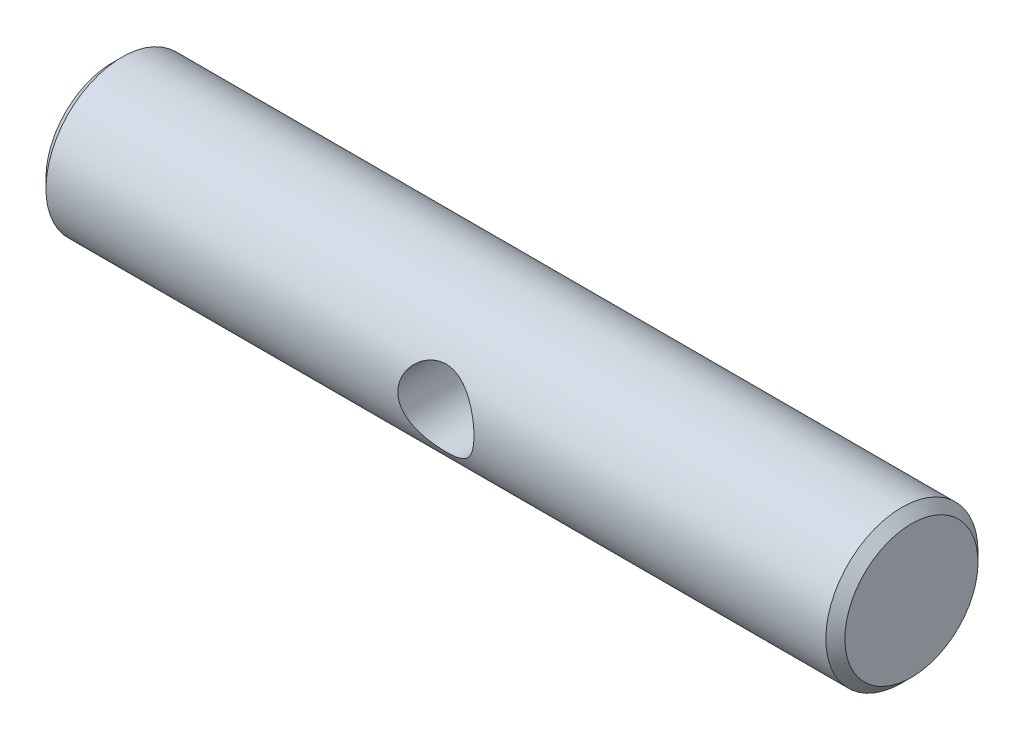
from build123d import *

# Parameters (mm, degrees)
CUT_EXTRUDE_START   = -3.5
CUT_EXTRUDE_1_DEPTH = 10
SKETCH_3_W          = 4
SKETCH_3_H          = 19.670556204
CUT_EXTRUDE_2_DEPTH = 10
CUT_EXTRUDE_START_2 = -29
SKETCH_4_R          = 4
SKETCH_4_R_2        = 2
CUT_EXTRUDE_3_DEPTH = 29
SKETCH_5_R          = 1
CUT_EXTRUDE_4_DEPTH = 5
CHAMFER_1_SIZE      = 0.25


with BuildPart() as part:
    # 草图1 → 旋转2 (revolve)
    with BuildSketch(Plane.XY, mode=Mode.PRIVATE) as revolve_2_sk:
        Polygon((0, 2), (0, 0), (17, 0), (21, 0), (21, 2), (17, 2), (17, 4), (4, 4), (4, 2), align=None)
    revolve(revolve_2_sk.sketch.rotate(Axis((-16.701754386, 0, 0), (1, 0, 0)), 180), axis=Axis((-16.701754386, 0, 0), (1, 0, 0)))

    # 草图2 → 切除-拉伸1 (cut)
    with BuildSketch(Plane.XY.offset(CUT_EXTRUDE_START)):
        Polygon((12.5, -5.827233832), (12.5, 4), (10.5, 4), (8.5, 4), (8.5, -5.827233832), align=None)
    extrude(amount=-CUT_EXTRUDE_1_DEPTH, mode=Mode.SUBTRACT)

    # 草图3 → 切除-拉伸2 (cut)
    with BuildSketch(Plane(origin=(0, 0, 0), x_dir=(1, 0, 0), z_dir=(0, 1, 0)).offset(CUT_EXTRUDE_START)):
        with Locations((10.5, 3.5)):
            Rectangle(SKETCH_3_W, SKETCH_3_H)
    extrude(amount=-CUT_EXTRUDE_2_DEPTH, mode=Mode.SUBTRACT)

    # 草图4 → 切除-拉伸3 (cut)
    with BuildSketch(Plane(origin=(21, 0, 0), x_dir=(0, 0, -1), z_dir=(1, 0, 0)).offset(CUT_EXTRUDE_START_2)):
        Circle(SKETCH_4_R)
        with Locations(Location((0, 0, 0), (0, 0, 270))):
            Circle(SKETCH_4_R_2, mode=Mode.SUBTRACT)
    extrude(amount=CUT_EXTRUDE_3_DEPTH, mode=Mode.SUBTRACT)

    # 草图5 → 切除-拉伸4 (cut, symmetric)
    with BuildSketch(Plane.XY):
        with Locations((10.5, 0)):
            Circle(SKETCH_5_R)
    extrude(amount=CUT_EXTRUDE_4_DEPTH, both=True, mode=Mode.SUBTRACT)

    # 倒角1
    chamfer_1_edges = [part.edges().sort_by_distance(p)[0] for p in [
        (0, 2, 0),
        (21, 2, 0),
    ]]
    chamfer(chamfer_1_edges, length=CHAMFER_1_SIZE)


solid = part.part
